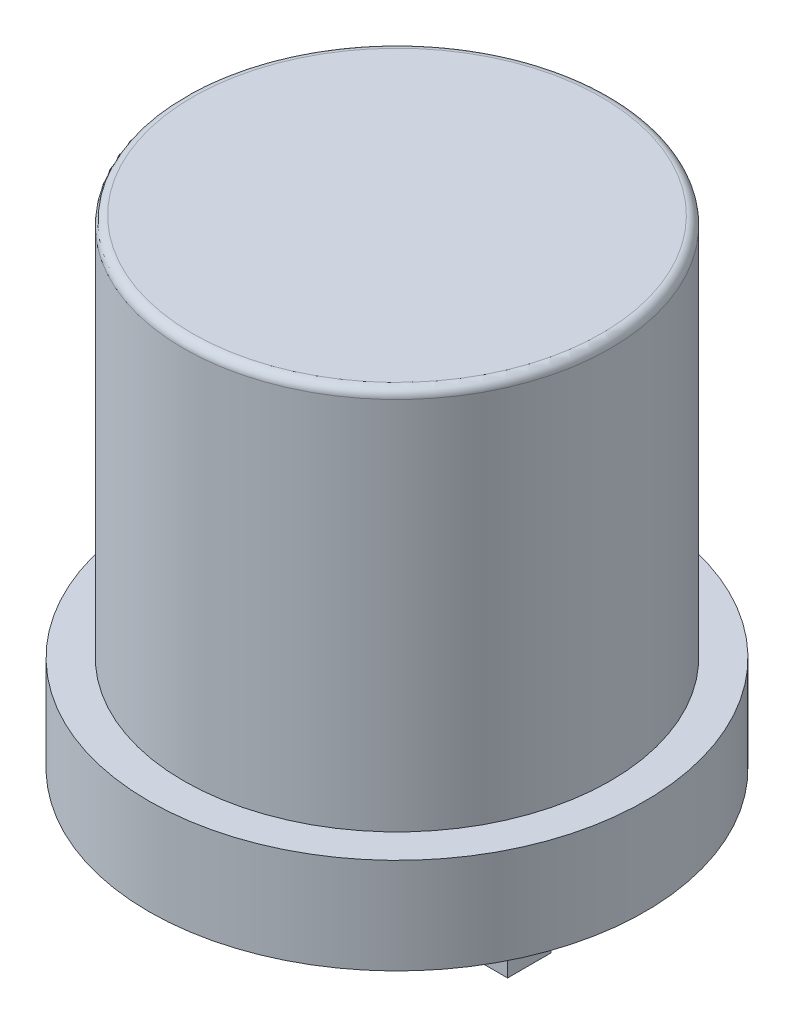
from build123d import *

# Parameters (mm, degrees)
SKETCH_1_W          = 2.85
SKETCH_1_H          = 1.1
SKETCH_2_W          = 0.5
SKETCH_2_H          = 0.5
EXTRUDE_1_DEPTH     = 1.2
SKETCH_3_W          = 0.5
SKETCH_3_H          = 0.5
EXTRUDE_2_DEPTH     = 1.2
SKETCH_4_R          = 2.45
EXTRUDE_3_DEPTH     = 4.4
FILLET_1_R          = 0.1
CUT_EXTRUDE_1_DEPTH = 0.3
SKETCH_7_R          = 0.071568043
SKETCH_7_R_2        = 0.102987613
CUT_EXTRUDE_2_DEPTH = 1


with BuildPart() as part:
    # 草图1 → 旋转1 (revolve)
    with BuildSketch(Plane.XY, mode=Mode.PRIVATE) as revolve_1_sk:
        with Locations((1.425, 0.55)):
            Rectangle(SKETCH_1_W, SKETCH_1_H)
    revolve(revolve_1_sk.sketch.rotate(Axis((0, 1.1, 0), (0, -1, 0)), 270), axis=Axis((0, 1.1, 0), (0, -1, 0)))

    # 草图2 → 凸台-拉伸1 (add)
    with BuildSketch(Plane.XZ):
        with Locations((1.27, 0)):
            Rectangle(SKETCH_2_W, SKETCH_2_H)
    extrude(amount=EXTRUDE_1_DEPTH)

    # 草图3 → 凸台-拉伸2 (add)
    with BuildSketch(Plane.XZ):
        with Locations((-1.27, 0)):
            Rectangle(SKETCH_3_W, SKETCH_3_H)
    extrude(amount=EXTRUDE_2_DEPTH)

    # 草图4 → 凸台-拉伸3 (add)
    with BuildSketch(Plane(origin=(0, 1.1, 0), x_dir=(-1, 0, 0), z_dir=(0, 1, 0))):
        with Locations(Location((0, 0, 0), (0, 0, 90))):
            Circle(SKETCH_4_R)
    extrude(amount=EXTRUDE_3_DEPTH)

    # 圆角1
    fillet_1_edges = [part.edges().sort_by_distance(p)[0] for p in [
        (0, 5.5, -2.45),
    ]]
    fillet(fillet_1_edges, radius=FILLET_1_R)

    # 草图6 → 切除-拉伸1 (cut, symmetric)
    with BuildSketch(Plane.XY):
        Polygon((-1.02, 3.852964397), (-0.181256176, 3.852964397), (-1.27, 4.752964397), (-1.27, 3.852964397), (-1.52, 3.852964397), (-1.52, 0.252964397), (-1.02, 0.252964397), align=None)
        Polygon((1.52, 0.252964397), (1.02, 0.252964397), (1.02, 3.516785867), (-0.475424156, 4.752964397), (1.52, 4.752964397), align=None)
    extrude(amount=CUT_EXTRUDE_1_DEPTH, both=True, mode=Mode.SUBTRACT)

    # 草图7 → 切除-拉伸2 (cut)
    with BuildSketch(Plane.XZ.offset(1.2)):
        with Locations(Location((-1.27, 0, 0), (0, 0, 270))):
            Circle(SKETCH_7_R)
        with Locations(Location((1.27, 0, 0), (0, 0, 270))):
            Circle(SKETCH_7_R_2)
    extrude(amount=-CUT_EXTRUDE_2_DEPTH, mode=Mode.SUBTRACT)


solid = part.part
